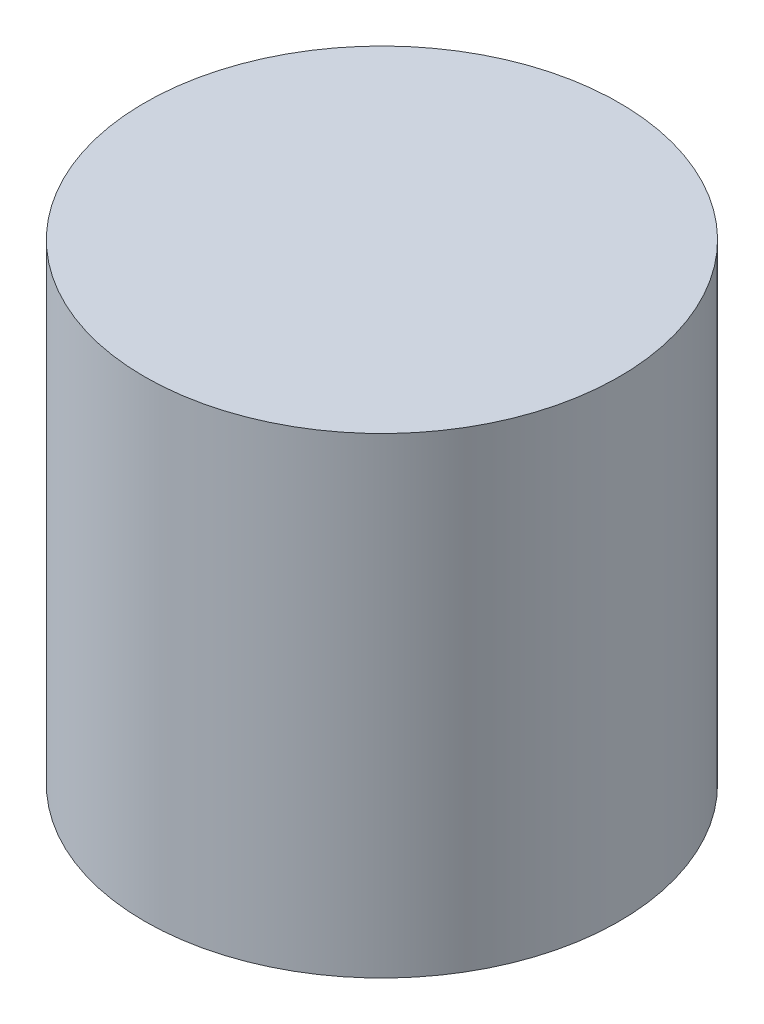
from build123d import *

# Parameters (mm, degrees)
SKETCH1_R           = 3.937
BOSS_EXTRUDE1_DEPTH = 7.8232


with BuildPart() as part:
    # Sketch1 → Boss-Extrude1 (new body)
    with BuildSketch(Plane(origin=(0, 0, 0), x_dir=(1, 0, 0), z_dir=(0, 1, 0))):
        with Locations(Location((0, 0, 0), (0, 0, 270))):
            Circle(SKETCH1_R)
    extrude(amount=BOSS_EXTRUDE1_DEPTH)


solid = part.part
